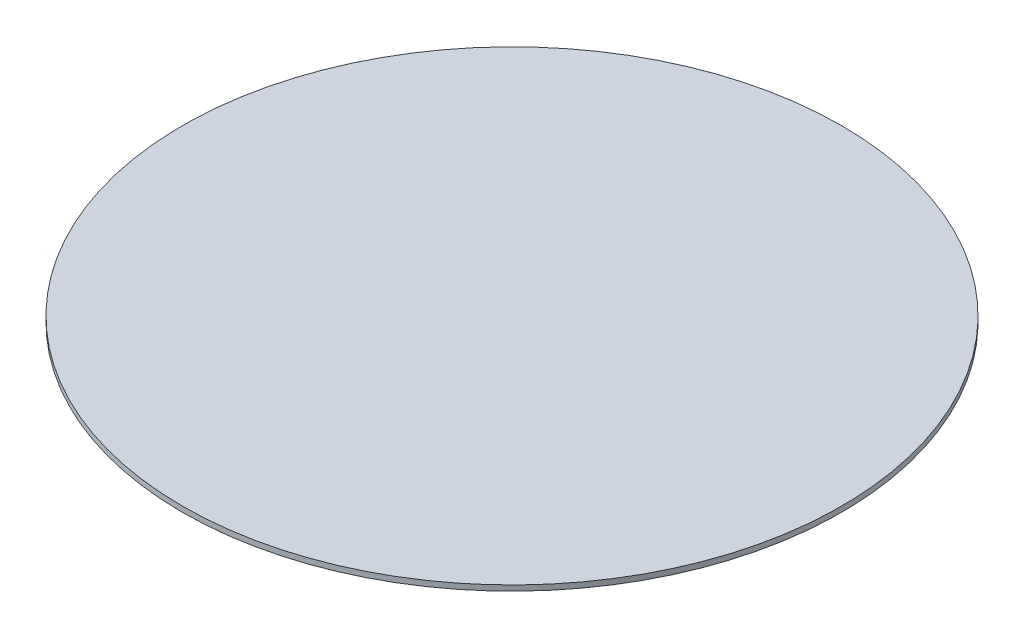
from build123d import *

# Parameters (mm, degrees)
SKETCH1_R           = 609.6
BOSS_EXTRUDE1_DEPTH = 10


with BuildPart() as part:
    # Sketch1 → Boss-Extrude1 (new body)
    with BuildSketch(Plane(origin=(0, 0, 0), x_dir=(1, 0, 0), z_dir=(0, 1, 0))):
        with Locations(Location((0, 0, 0), (0, 0, 270))):
            Circle(SKETCH1_R)
    extrude(amount=BOSS_EXTRUDE1_DEPTH)


solid = part.part
